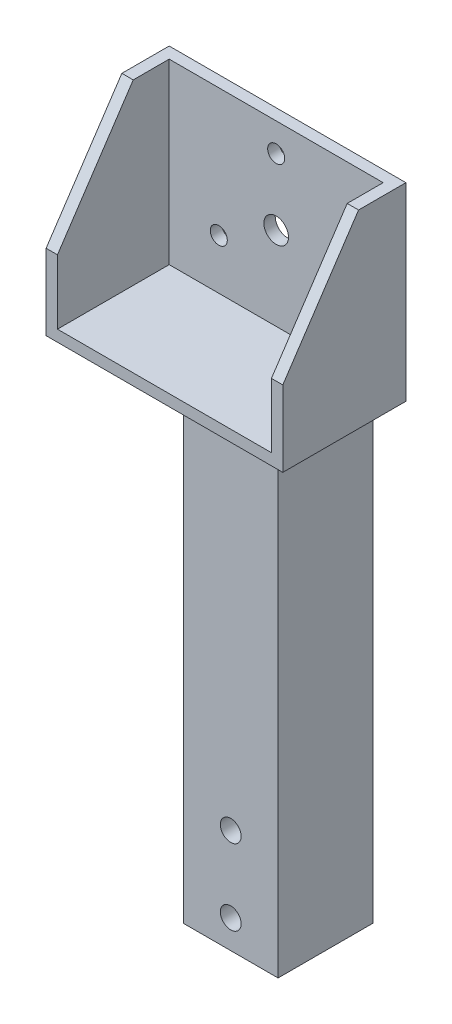
from build123d import *

# Parameters (mm, degrees)
SKETCH_1_W               = 125
SKETCH_1_H               = 100
EXTRUDE_1_DEPTH          = 65
SHELL_1_T                = -6
CUT_EXTRUDE_1_REACH      = 174.772
SKETCH_3_W               = 50
SKETCH_3_H               = 50
EXTRUDE_2_DEPTH          = 240
SKETCH_4_R               = 5.5
CUT_EXTRUDE_2_DEPTH      = 240
SKETCH_5_R               = 6.5
CUT_EXTRUDE_5_DEPTH      = 240
SKETCH_6_R               = 4.5
CUT_EXTRUDE_6_DEPTH      = 240
PATTERN_CIRCULAR_1_COUNT = 3


with BuildPart() as part:
    # 草图1 → 凸台-拉伸1 (new body)
    with BuildSketch(Plane.XY):
        with Locations((62.5, 50)):
            Rectangle(SKETCH_1_W, SKETCH_1_H)
    extrude(amount=EXTRUDE_1_DEPTH)

    # 抽壳1
    shell_1_openings = [part.faces().sort_by_distance(p)[0] for p in [
        (62.5, 50, 65),
        (62.5, 100, 32.5),
    ]]
    offset(amount=SHELL_1_T, openings=shell_1_openings, kind=Kind.INTERSECTION)

    # 切除-拉伸1: up to this face of the body (flat: up to its plane)
    cut_extrude_1_end = Plane(part.part.faces().sort_by_distance((0, 50, 32.5))[0])
    # 草图2 → 切除-拉伸1 (cut, up to the picked face)
    with BuildSketch(Plane(origin=(125, 0, 0), x_dir=(0, 0, -1), z_dir=(1, 0, 0)), mode=Mode.PRIVATE) as cut_extrude_1_sk1:
        Polygon((-65, 100), (-25, 100), (-65, 40), align=None)
    cut_extrude_1_tool1 = split(extrude(cut_extrude_1_sk1.sketch, amount=-CUT_EXTRUDE_1_REACH, mode=Mode.PRIVATE), bisect_by=cut_extrude_1_end, keep=Keep.BOTH, mode=Mode.PRIVATE)
    add(cut_extrude_1_tool1.solids().sort_by(Axis((125, 80, 51.666667), (-1, 0, 0)))[0], mode=Mode.SUBTRACT)

    # 草图3 → 凸台-拉伸2 (add)
    with BuildSketch(Plane.XZ):
        with Locations((90, 32.5)):
            Rectangle(SKETCH_3_W, SKETCH_3_H)
    extrude(amount=EXTRUDE_2_DEPTH)

    # 草图4 → 切除-拉伸2 (cut)
    with BuildSketch(Plane.XY.offset(57.5)):
        with Locations((90, -225)):
            Circle(SKETCH_4_R)
        with Locations((90, -185)):
            Circle(SKETCH_4_R)
    extrude(amount=-CUT_EXTRUDE_2_DEPTH, mode=Mode.SUBTRACT)

    # 草图5 → 切除-拉伸5 (cut)
    with BuildSketch(Plane(origin=(0, 0, 0), x_dir=(-1, 0, 0), z_dir=(0, 0, -1))):
        with Locations((-62.5, 50)):
            Circle(SKETCH_5_R)
    extrude(amount=-CUT_EXTRUDE_5_DEPTH, mode=Mode.SUBTRACT)

    # 草图6 → 切除-拉伸6 (cut)
    with BuildSketch(Plane(origin=(0, 0, 0), x_dir=(-1, 0, 0), z_dir=(0, 0, -1))):
        with Locations((-62.5, 85)):
            Circle(SKETCH_6_R)
    cut_extrude_6 = extrude(amount=-CUT_EXTRUDE_6_DEPTH, mode=Mode.SUBTRACT)

    # 阵列(圆周)1: 切除-拉伸6 ×3 about axis
    pattern_circular_1_axis = Axis((62.5, 50, 0), (0, 0, 1))
    for i in range(1, PATTERN_CIRCULAR_1_COUNT):
        add(cut_extrude_6.rotate(pattern_circular_1_axis, i * 360 / PATTERN_CIRCULAR_1_COUNT), mode=Mode.SUBTRACT)


solid = part.part
